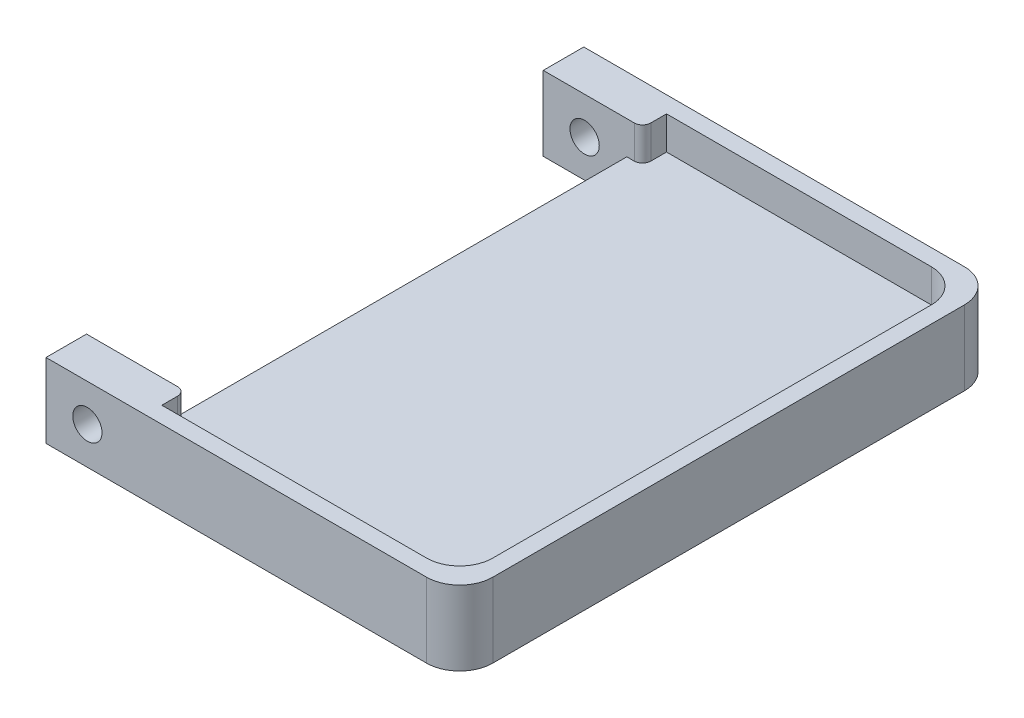
from build123d import *

# Parameters (mm, degrees)
SKETCH1_W           = 63.5
SKETCH1_H           = 11.43
BOSS_EXTRUDE1_DEPTH = 82.55
SKETCH2_W           = 45.72
SKETCH2_H           = 77.47
CUT_EXTRUDE1_DEPTH  = 5.08
SKETCH3_W           = 13.335
SKETCH3_H           = 70.104
CUT_EXTRUDE2_DEPTH  = 105.77307574
SKETCH4_W           = 1.905
SKETCH4_H           = 70.104
CUT_EXTRUDE3_DEPTH  = 5.08
FILLET1_R           = 5.08
FILLET2_R           = 5.08
FILLET3_R           = 1.27
SKETCH5_R           = 2.2479
CUT_EXTRUDE4_DEPTH  = 105.77307574
SKETCH6_W           = 70.104
SKETCH6_H           = 6.35
BOSS_EXTRUDE2_DEPTH = 0.508


with BuildPart() as part:
    # Sketch1 → Boss-Extrude1 (new body)
    with BuildSketch(Plane.XY):
        with Locations((31.75, 5.715)):
            Rectangle(SKETCH1_W, SKETCH1_H)
    extrude(amount=BOSS_EXTRUDE1_DEPTH)

    # Sketch2 → Cut-Extrude1 (cut)
    with BuildSketch(Plane(origin=(0, 11.43, 0), x_dir=(1, 0, 0), z_dir=(0, 1, 0))):
        with Locations((38.1, -41.275)):
            Rectangle(SKETCH2_W, SKETCH2_H)
    extrude(amount=-CUT_EXTRUDE1_DEPTH, mode=Mode.SUBTRACT)

    # Sketch3 → Cut-Extrude2 (cut, through all)
    with BuildSketch(Plane(origin=(0, 11.43, 0), x_dir=(1, 0, 0), z_dir=(0, 1, 0))):
        with Locations((6.6675, -41.275)):
            Rectangle(SKETCH3_W, SKETCH3_H)
    extrude(amount=-CUT_EXTRUDE2_DEPTH, mode=Mode.SUBTRACT)

    # Sketch4 → Cut-Extrude3 (cut)
    with BuildSketch(Plane(origin=(0, 11.43, 0), x_dir=(1, 0, 0), z_dir=(0, 1, 0))):
        with Locations((14.2875, -41.275)):
            Rectangle(SKETCH4_W, SKETCH4_H)
    extrude(amount=-CUT_EXTRUDE3_DEPTH, mode=Mode.SUBTRACT)

    # Fillet1
    fillet1_edges = [part.edges().sort_by_distance(p)[0] for p in [
        (60.96, 8.89, 2.54),
        (60.96, 8.89, 80.01),
    ]]
    fillet(fillet1_edges, radius=FILLET1_R)

    # Fillet2
    fillet2_edges = [part.edges().sort_by_distance(p)[0] for p in [
        (63.5, 5.715, 82.55),
        (63.5, 5.715, 0),
    ]]
    fillet(fillet2_edges, radius=FILLET2_R)

    # Fillet3
    fillet3_edges = [part.edges().sort_by_distance(p)[0] for p in [
        (15.24, 8.89, 6.223),
        (15.24, 8.89, 76.327),
    ]]
    fillet(fillet3_edges, radius=FILLET3_R)

    # Sketch5 → Cut-Extrude4 (cut, through all)
    with BuildSketch(Plane.XY.offset(82.55)):
        with Locations((6.35, 5.715)):
            Circle(SKETCH5_R)
    extrude(amount=-CUT_EXTRUDE4_DEPTH, mode=Mode.SUBTRACT)

    # Sketch6 → Boss-Extrude2 (add)
    with BuildSketch(Plane.ZY.offset(-13.335)):
        with Locations((41.275, 3.175)):
            Rectangle(SKETCH6_W, SKETCH6_H)
    extrude(amount=BOSS_EXTRUDE2_DEPTH)


solid = part.part
